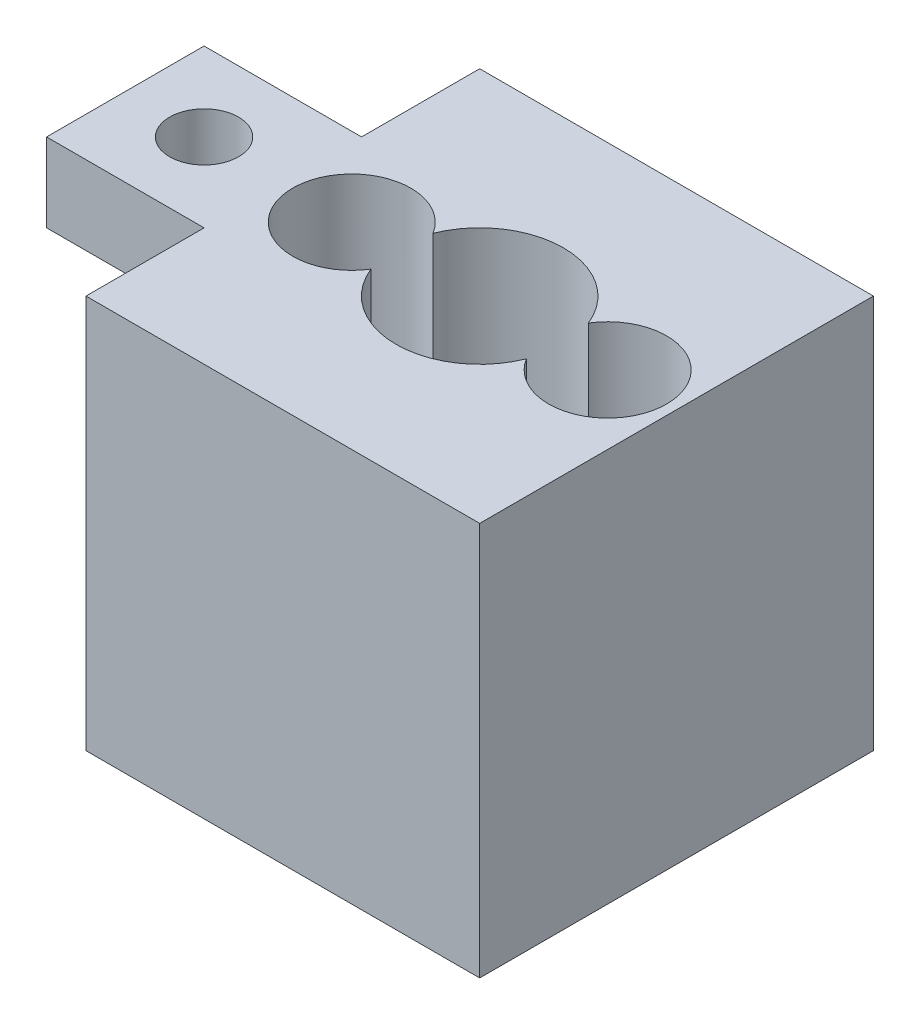
from build123d import *

# Parameters (mm, degrees)
SKETCH1_W               = 20
SKETCH1_H               = 20
BOSS_EXTRUDE1_DEPTH     = 20
SKETCH2_R               = 4.25
CUT_EXTRUDE1_DEPTH      = 10
SKETCH3_R               = 1.75
CUT_EXTRUDE2_DEPTH      = 25.494897428
SKETCH4_R               = 3
CUT_EXTRUDE3_DEPTH      = 15
SKETCH5_W               = 8
SKETCH5_H               = 4
BOSS_EXTRUDE2_DEPTH     = 8
CUT_EXTRUDE4_DEPTH      = 27.076809621
CUT_EXTRUDE4_DEPTH_BACK = 27.076809621
SKETCH6_R               = 1.75


with BuildPart() as part:
    # Sketch1 → Boss-Extrude1 (new body)
    with BuildSketch(Plane(origin=(0, 0, 0), x_dir=(1, 0, 0), z_dir=(0, 1, 0))):
        Rectangle(SKETCH1_W, SKETCH1_H)
    extrude(amount=BOSS_EXTRUDE1_DEPTH)

    # Sketch2 → Cut-Extrude1 (cut)
    with BuildSketch(Plane(origin=(0, 20, 0), x_dir=(1, 0, 0), z_dir=(0, 1, 0))):
        with Locations(Location((0, 0, 0), (0, 0, 270))):
            Circle(SKETCH2_R)
    extrude(amount=-CUT_EXTRUDE1_DEPTH, mode=Mode.SUBTRACT)

    # Sketch3 → Cut-Extrude2 (cut, through all)
    with BuildSketch(Plane(origin=(0, 20, 0), x_dir=(1, 0, 0), z_dir=(0, 1, 0))):
        with Locations(Location((-6.5, 0, 0), (0, 0, 270))):
            Circle(SKETCH3_R)
        with Locations(Location((6.5, 0, 0), (0, 0, 270))):
            Circle(SKETCH3_R)
    extrude(amount=-CUT_EXTRUDE2_DEPTH, mode=Mode.SUBTRACT)

    # Sketch4 → Cut-Extrude3 (cut)
    with BuildSketch(Plane(origin=(0, 20, 0), x_dir=(1, 0, 0), z_dir=(0, 1, 0))):
        with Locations(Location((-6.5, 0, 0), (0, 0, 270))):
            Circle(SKETCH4_R)
        with Locations(Location((6.5, 0, 0), (0, 0, 270))):
            Circle(SKETCH4_R)
    extrude(amount=-CUT_EXTRUDE3_DEPTH, mode=Mode.SUBTRACT)

    # Sketch5 → Boss-Extrude2 (add)
    with BuildSketch(Plane.ZY.offset(10)):
        with Locations((0, 18)):
            Rectangle(SKETCH5_W, SKETCH5_H)
    extrude(amount=BOSS_EXTRUDE2_DEPTH)

    # Sketch6 → Cut-Extrude4 (cut, two sides: drawn at the far end of the back side and taken through both)
    with BuildSketch(Plane.XZ.offset(-16).offset(-CUT_EXTRUDE4_DEPTH_BACK)):
        with Locations(Location((-14, 0, 0), (0, 0, 270))):
            Circle(SKETCH6_R)
    extrude(amount=CUT_EXTRUDE4_DEPTH + CUT_EXTRUDE4_DEPTH_BACK, mode=Mode.SUBTRACT)


solid = part.part
